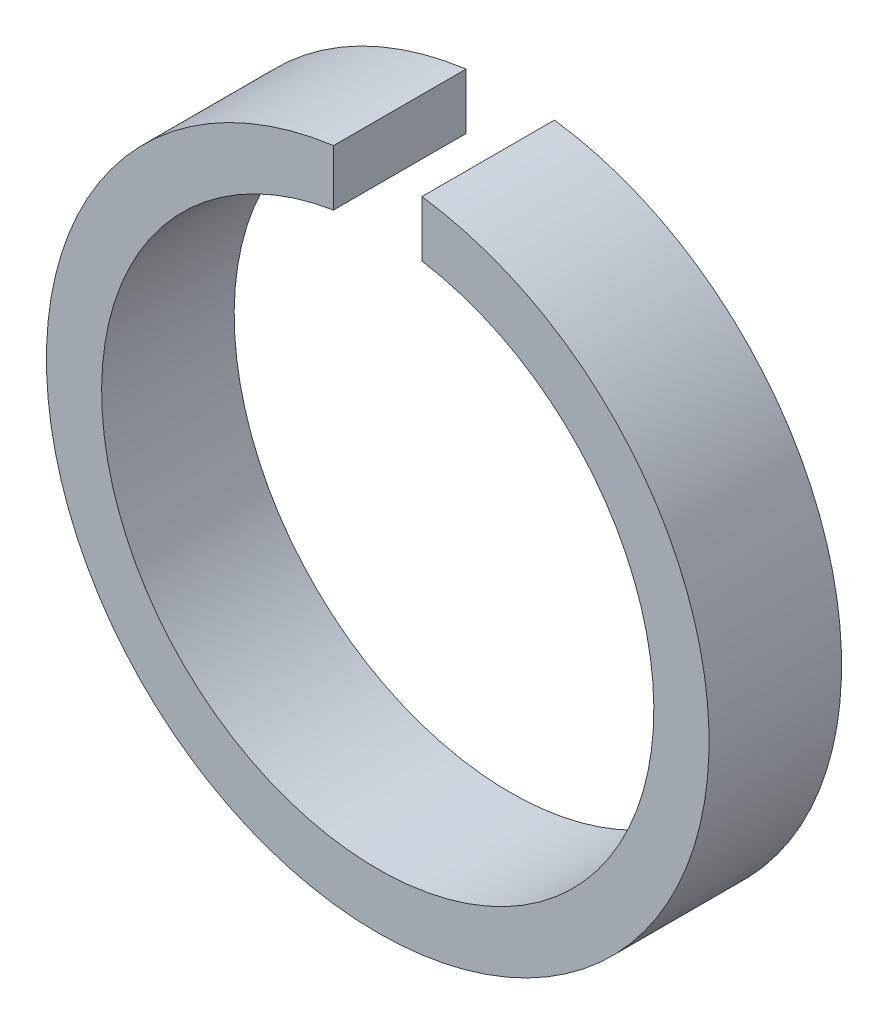
from build123d import *

# Parameters (mm, degrees)
SKETCH_1_R          = 7.5
SKETCH_1_R_2        = 6.25
EXTRUDE_1_DEPTH     = 3
SKETCH_2_W          = 2
SKETCH_2_H          = 7.5
CUT_EXTRUDE_1_DEPTH = 12.022703843


with BuildPart() as part:
    # 草图1 → 凸台-拉伸1 (new body)
    with BuildSketch(Plane.XY):
        Circle(SKETCH_1_R)
        Circle(SKETCH_1_R_2, mode=Mode.SUBTRACT)
    extrude(amount=EXTRUDE_1_DEPTH)

    # 草图2 → 切除-拉伸1 (cut, through all)
    with BuildSketch(Plane.XY.offset(3)):
        with Locations((0, 3.75)):
            Rectangle(SKETCH_2_W, SKETCH_2_H)
    extrude(amount=-CUT_EXTRUDE_1_DEPTH, mode=Mode.SUBTRACT)


solid = part.part
